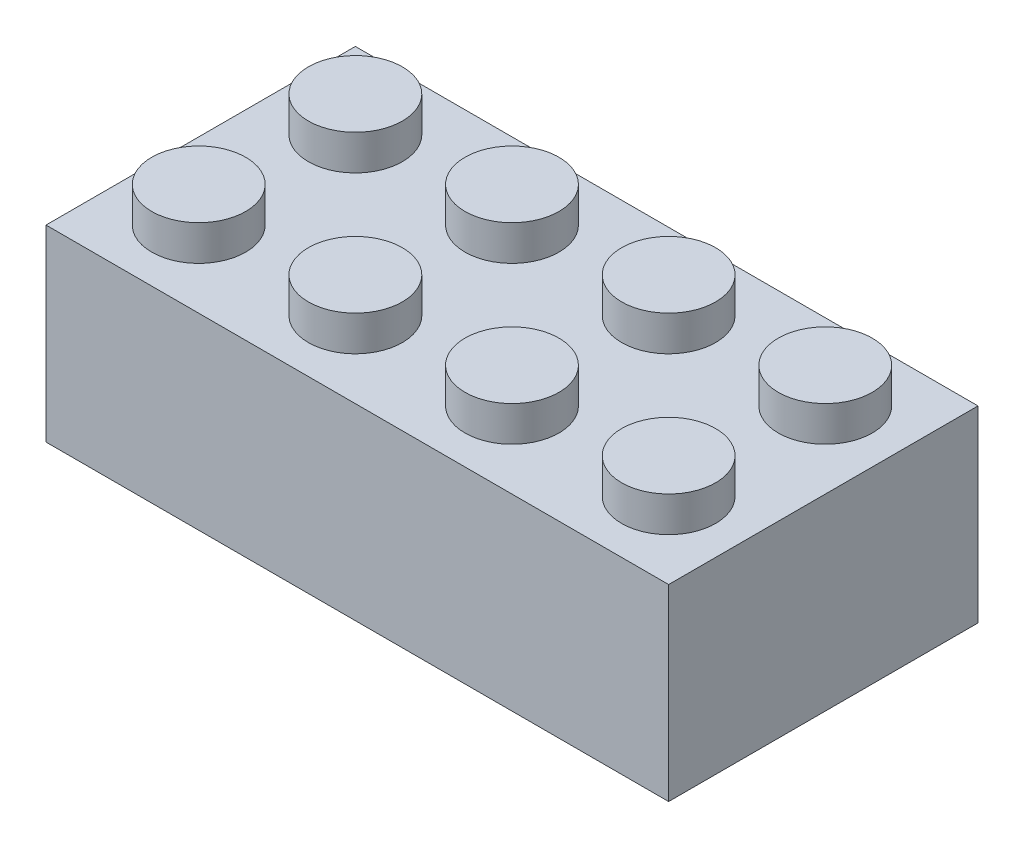
from build123d import *

# Parameters (mm, degrees)
SKETCH1_W           = 31.8
SKETCH1_H           = 15.8
BOSS_EXTRUDE1_DEPTH = 9.6
SKETCH3_W           = 31.8
SKETCH3_H           = 15.8
BOSS_EXTRUDE2_DEPTH = 1
SKETCH4_R           = 2.4
BOSS_EXTRUDE3_DEPTH = 1.8
SKETCH5_R           = 1.3
CUT_EXTRUDE1_DEPTH  = 1.7
SKETCH6_R           = 3.255
SKETCH6_R_2         = 2.4
SKETCH6_R_3         = 3.225
BOSS_EXTRUDE4_DEPTH = 8.6
SKETCH7_W           = 0.8
SKETCH7_H           = 3.759344576
SKETCH7_H_2         = 3.840900034
BOSS_EXTRUDE5_DEPTH = 6.3


with BuildPart() as part:
    # Sketch1 → Boss-Extrude1 (new body)
    with BuildSketch(Plane(origin=(0, 0, 0), x_dir=(1, 0, 0), z_dir=(0, 1, 0))):
        Rectangle(SKETCH1_W, SKETCH1_H)
        Polygon((-12.3, -6.7), (-14.7, -6.7), (-14.7, -4.3), (-14.5, -4.3), (-14.5, -3.7), (-14.7, -3.7), (-14.7, 3.7), (-14.5, 3.7), (-14.5, 4.3), (-14.7, 4.3), (-14.7, 6.7), (-12.3, 6.7), (-12.3, 6.5), (-11.7, 6.5), (-11.7, 6.7), (-4.3, 6.7), (-4.3, 6.5), (-3.7, 6.5), (-3.7, 6.7), (3.7, 6.7), (3.7, 6.5), (4.3, 6.5), (4.3, 6.7), (11.7, 6.7), (11.7, 6.5), (12.3, 6.5), (12.3, 6.7), (14.7, 6.7), (14.7, 4.3), (14.5, 4.3), (14.5, 3.7), (14.7, 3.7), (14.7, -3.7), (14.5, -3.7), (14.5, -4.3), (14.7, -4.3), (14.7, -6.7), (12.3, -6.7), (12.3, -6.5), (11.7, -6.5), (11.7, -6.7), (4.3, -6.7), (4.3, -6.5), (3.7, -6.5), (3.7, -6.7), (-3.7, -6.7), (-3.7, -6.5), (-4.3, -6.5), (-4.3, -6.7), (-11.7, -6.7), (-11.7, -6.5), (-12.3, -6.5), align=None, mode=Mode.SUBTRACT)
    extrude(amount=BOSS_EXTRUDE1_DEPTH)

    # Sketch3 → Boss-Extrude2 (add)
    with BuildSketch(Plane(origin=(0, 9.6, 0), x_dir=(1, 0, 0), z_dir=(0, 1, 0))):
        Rectangle(SKETCH3_W, SKETCH3_H)
    extrude(amount=-BOSS_EXTRUDE2_DEPTH)

    # Sketch4 → Boss-Extrude3 (add)
    with BuildSketch(Plane(origin=(0, 9.6, 0), x_dir=(1, 0, 0), z_dir=(0, 1, 0))):
        with Locations(Location((-12, 4, 0), (0, 0, 270))):
            Circle(SKETCH4_R)
        with Locations(Location((-4, 4, 0), (0, 0, 270))):
            Circle(SKETCH4_R)
        with Locations(Location((4, 4, 0), (0, 0, 270))):
            Circle(SKETCH4_R)
        with Locations(Location((12, 4, 0), (0, 0, 270))):
            Circle(SKETCH4_R)
        with Locations(Location((-12, -4, 0), (0, 0, 270))):
            Circle(SKETCH4_R)
        with Locations(Location((-4, -4, 0), (0, 0, 270))):
            Circle(SKETCH4_R)
        with Locations(Location((4, -4, 0), (0, 0, 270))):
            Circle(SKETCH4_R)
        with Locations(Location((12, -4, 0), (0, 0, 270))):
            Circle(SKETCH4_R)
    extrude(amount=BOSS_EXTRUDE3_DEPTH)

    # Sketch5 → Cut-Extrude1 (cut)
    with BuildSketch(Plane.XZ.offset(-8.6)):
        with Locations(Location((12, -4, 0), (0, 0, 270))):
            Circle(SKETCH5_R)
        with Locations(Location((12, 4, 0), (0, 0, 270))):
            Circle(SKETCH5_R)
        with Locations(Location((4, -4, 0), (0, 0, 270))):
            Circle(SKETCH5_R)
        with Locations(Location((4, 4, 0), (0, 0, 270))):
            Circle(SKETCH5_R)
        with Locations(Location((-4, 4, 0), (0, 0, 270))):
            Circle(SKETCH5_R)
        with Locations(Location((-4, -4, 0), (0, 0, 270))):
            Circle(SKETCH5_R)
        with Locations(Location((-12, -4, 0), (0, 0, 270))):
            Circle(SKETCH5_R)
        with Locations(Location((-12, 4, 0), (0, 0, 270))):
            Circle(SKETCH5_R)
    extrude(amount=-CUT_EXTRUDE1_DEPTH, mode=Mode.SUBTRACT)

    # Sketch6 → Boss-Extrude4 (add)
    # profile 1 of 3: a face of its own
    with BuildSketch(Plane.XZ.offset(-8.6)):
        with Locations(Location((8, 0, 0), (0, 0, 90))):
            Circle(SKETCH6_R)
        with Locations(Location((8, 0, 0), (0, 0, 90))):
            Circle(SKETCH6_R_2, mode=Mode.SUBTRACT)
    # profile 2 of 3: a face of its own
    with BuildSketch(Plane.XZ.offset(-8.6)):
        with Locations(Location((-8, 0, 0), (0, 0, 90))):
            Circle(SKETCH6_R)
        with Locations(Location((-8, 0, 0), (0, 0, 90))):
            Circle(SKETCH6_R_2, mode=Mode.SUBTRACT)
    # profile 3 of 3: a face of its own
    with BuildSketch(Plane.XZ.offset(-8.6)):
        with Locations(Location((0, 0, 0), (0, 0, 90))):
            Circle(SKETCH6_R_3)
        with Locations(Location((0, 0, 0), (0, 0, 90))):
            Circle(SKETCH6_R_2, mode=Mode.SUBTRACT)
    extrude(amount=BOSS_EXTRUDE4_DEPTH)

    # Sketch7 → Boss-Extrude5 (add)
    with BuildSketch(Plane.XZ.offset(-8.6)):
        with Locations((0, -4.820327712)):
            Rectangle(SKETCH7_W, SKETCH7_H)
        with Locations((0, 4.779549983)):
            Rectangle(SKETCH7_W, SKETCH7_H_2)
    extrude(amount=BOSS_EXTRUDE5_DEPTH)


solid = part.part
